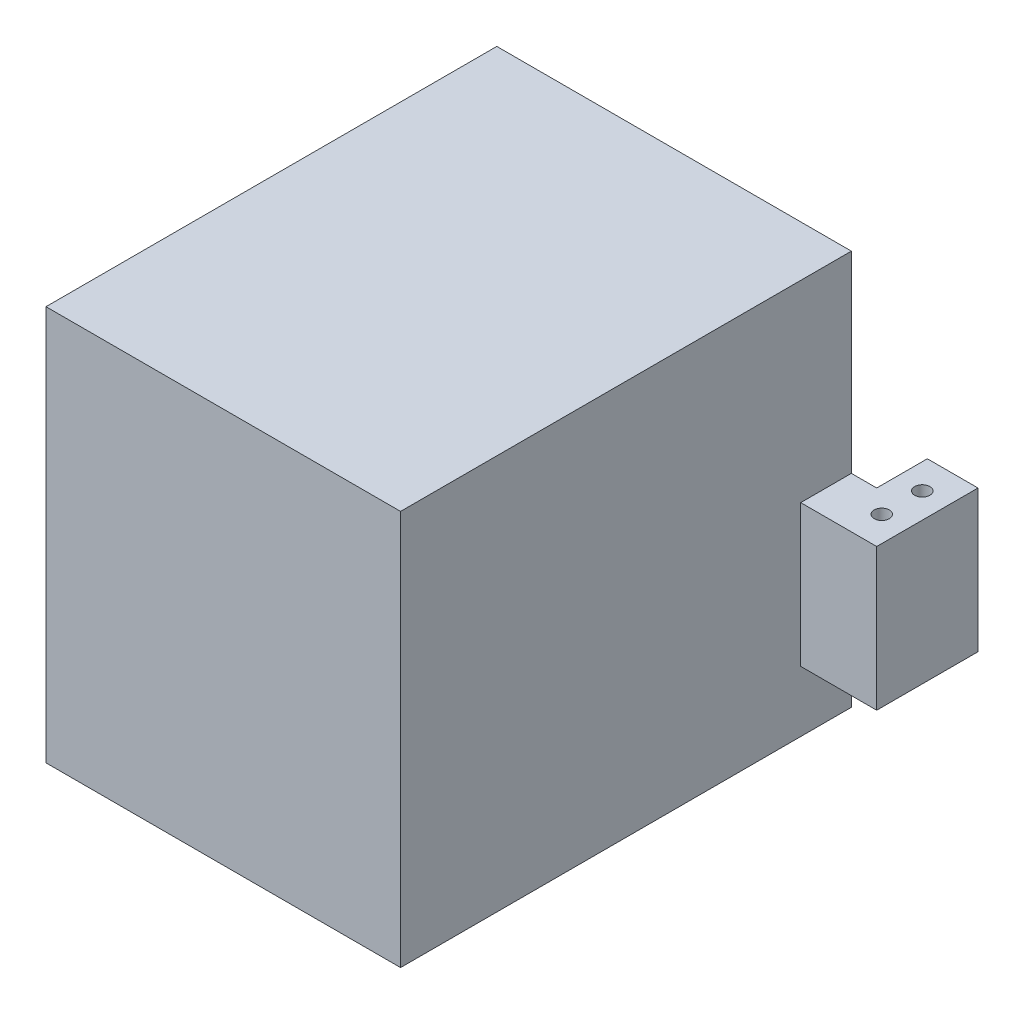
from build123d import *

# Parameters (mm, degrees)
SKETCH_1_W            = 100
SKETCH_1_H            = 28
EXTRUDE_1_DEPTH       = 20
SKETCH_2_W            = 80
SKETCH_2_H            = 10
CUT_EXTRUDE_1_DEPTH   = 59.172158289
SKETCH_3_W            = 70
SKETCH_3_H            = 10
EXTRUDE_2_DEPTH       = 25
SKETCH_4_W            = 70
SKETCH_4_H            = 10
EXTRUDE_3_DEPTH       = 12
HOLE_WIZARD_3_0_3_1_D = 3
HOLE_WIZARD_3_0_3_2_D = 3
SKETCH_13_W           = 70
SKETCH_13_H           = 5
EXTRUDE_4_DEPTH       = 10
CUT_EXTRUDE_3_DEPTH   = 10
EXTRUDE_5_DEPTH       = 74
SKETCH_17_W           = 70
SKETCH_17_H           = 5
EXTRUDE_6_DEPTH       = 70
SKETCH_18_W           = 70
SKETCH_18_H           = 89
EXTRUDE_7_DEPTH       = 8


with BuildPart() as part:
    # 草图1 → 凸台-拉伸1 (new body)
    with BuildSketch(Plane(origin=(0, 0, -10), x_dir=(-1, 0, 0), z_dir=(0, 0, -1))):
        Rectangle(SKETCH_1_W, SKETCH_1_H)
    extrude(amount=-EXTRUDE_1_DEPTH)

    # 草图2 → 切除-拉伸1 (cut, through all)
    with BuildSketch(Plane(origin=(0, 14, 0), x_dir=(-1, 0, 0), z_dir=(0, 1, 0))):
        with Locations((0, -5)):
            Rectangle(SKETCH_2_W, SKETCH_2_H)
    extrude(amount=-CUT_EXTRUDE_1_DEPTH, mode=Mode.SUBTRACT)

    # 草图3 → 凸台-拉伸2 (add)
    with BuildSketch(Plane(origin=(0, 14, 0), x_dir=(-1, 0, 0), z_dir=(0, 1, 0))):
        with Locations((0, 5)):
            Rectangle(SKETCH_3_W, SKETCH_3_H)
    extrude(amount=EXTRUDE_2_DEPTH)

    # 草图4 → 凸台-拉伸3 (add)
    with BuildSketch(Plane.XZ.offset(14)):
        with Locations((0, 5)):
            Rectangle(SKETCH_4_W, SKETCH_4_H)
    extrude(amount=EXTRUDE_3_DEPTH)

    # Ø3.0 (3) 直径孔1 (through all)
    with Locations(Plane(origin=(0, 14, 0), x_dir=(1, 0, 0), z_dir=(0, 1, 0))):
        with Locations((-45, -4), (-45, 4)):
            Hole(HOLE_WIZARD_3_0_3_1_D / 2)

    # Ø3.0 (3) 直径孔2 (through all)
    with Locations(Plane(origin=(0, -14, 0), x_dir=(-1, 0, 0), z_dir=(0, -1, 0))):
        with Locations((-45, 4), (-45, -4)):
            Hole(HOLE_WIZARD_3_0_3_2_D / 2)

    # 草图13 → 凸台-拉伸4 (add)
    with BuildSketch(Plane(origin=(0, 0, 0), x_dir=(-1, 0, 0), z_dir=(0, 0, -1))):
        with Locations((0, 41.5)):
            Rectangle(SKETCH_13_W, SKETCH_13_H)
    extrude(amount=-EXTRUDE_4_DEPTH)

    # 草图15 → 切除-拉伸3 (cut)
    with BuildSketch(Plane(origin=(0, 0, 0), x_dir=(-1, 0, 0), z_dir=(0, 0, -1))):
        Polygon((0, -26), (30, -26), (30, 39), (-30, 39), (-30, -26), align=None)
    extrude(amount=-CUT_EXTRUDE_3_DEPTH, mode=Mode.SUBTRACT)

    # 草图16 → 凸台-拉伸5 (add)
    with BuildSketch(Plane.XY.offset(10)):
        Polygon((-35, -26), (-35, 44), (35, 44), (35, -26), (30, -26), (30, 39), (-30, 39), (-30, -26), align=None)
    extrude(amount=EXTRUDE_5_DEPTH)

    # 草图17 → 凸台-拉伸6 (add)
    with BuildSketch(Plane(origin=(0, 44, 0), x_dir=(1, 0, 0), z_dir=(0, 1, 0))):
        with Locations((0, -86.5)):
            Rectangle(SKETCH_17_W, SKETCH_17_H)
    extrude(amount=-EXTRUDE_6_DEPTH)

    # 草图18 → 凸台-拉伸7 (add)
    with BuildSketch(Plane(origin=(0, 44, 0), x_dir=(1, 0, 0), z_dir=(0, 1, 0))):
        with Locations((0, -44.5)):
            Rectangle(SKETCH_18_W, SKETCH_18_H)
    extrude(amount=EXTRUDE_7_DEPTH)


solid = part.part
